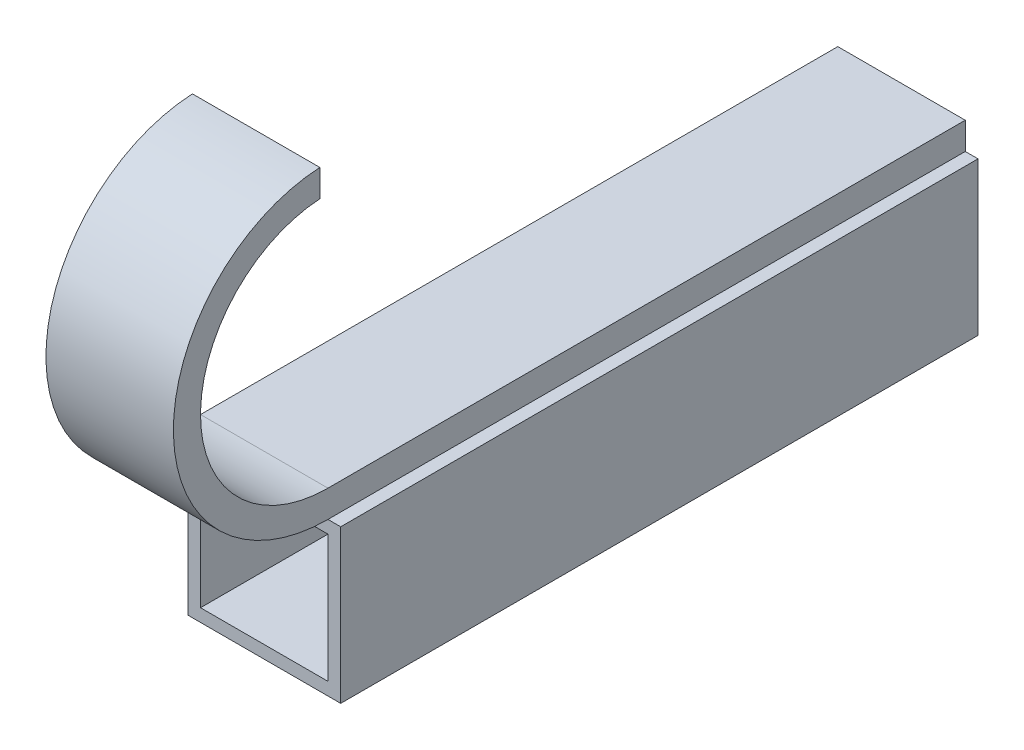
from build123d import *

# Parameters (mm, degrees)
SKETCH1_W           = 30.48
SKETCH1_H           = 30.48
SKETCH1_W_2         = 25.4
SKETCH1_H_2         = 25.4
BOSS_EXTRUDE1_DEPTH = 127
BOSS_EXTRUDE2_DEPTH = 12.7


with BuildPart() as part:
    # Sketch1 → Boss-Extrude1 (new body)
    with BuildSketch(Plane.XY):
        with Locations((12.7, 12.7)):
            Rectangle(SKETCH1_W, SKETCH1_H)
        with Locations((12.7, 12.7)):
            Rectangle(SKETCH1_W_2, SKETCH1_H_2, mode=Mode.SUBTRACT)
    extrude(amount=BOSS_EXTRUDE1_DEPTH)

    # Sketch2 → Boss-Extrude2 (add, symmetric)
    with BuildSketch(Plane(origin=(12.7, 0, 0), x_dir=(0, 0, -1), z_dir=(1, 0, 0))):
        with BuildLine():
            Line((0, 27.94), (0, 33.338518846))
            Line((0, 33.338518846), (-127, 33.338518846))
            ThreePointArc((-127, 33.338518846), (-152.387152316, 57.930745818), (-128.61472889, 84.087141109))
            Line((-128.61472889, 84.087141109), (-128.61472889, 89.494679428))
            ThreePointArc((-128.61472889, 89.494679428), (-157.787927459, 57.930876659), (-127, 27.94))
            Line((-127, 27.94), (0, 27.94))
        make_face()
    extrude(amount=BOSS_EXTRUDE2_DEPTH, both=True)


solid = part.part
